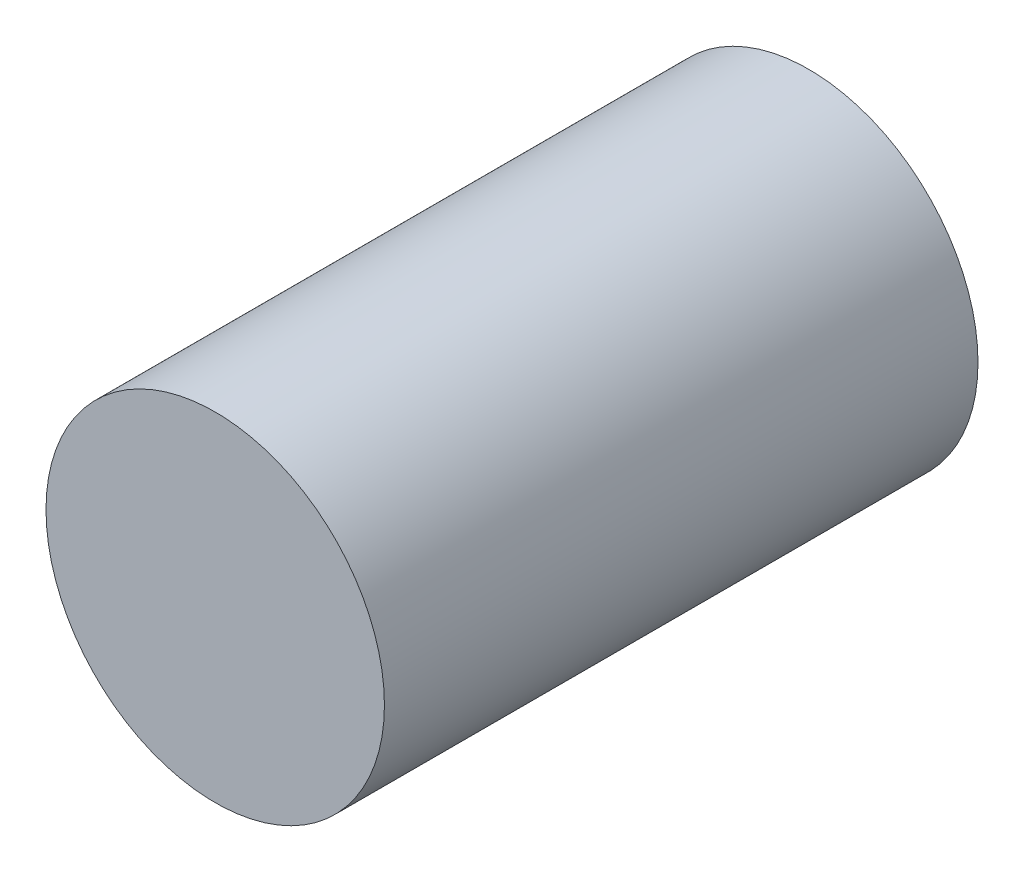
from build123d import *

# Parameters (mm, degrees)
SKETCH1_R      = 3.25
EXTRUDE1_DEPTH = 11.4


with BuildPart() as part:
    # Sketch1 → Extrude1 (new body)
    with BuildSketch(Plane.XY):
        Circle(SKETCH1_R)
    extrude(amount=EXTRUDE1_DEPTH)


solid = part.part
